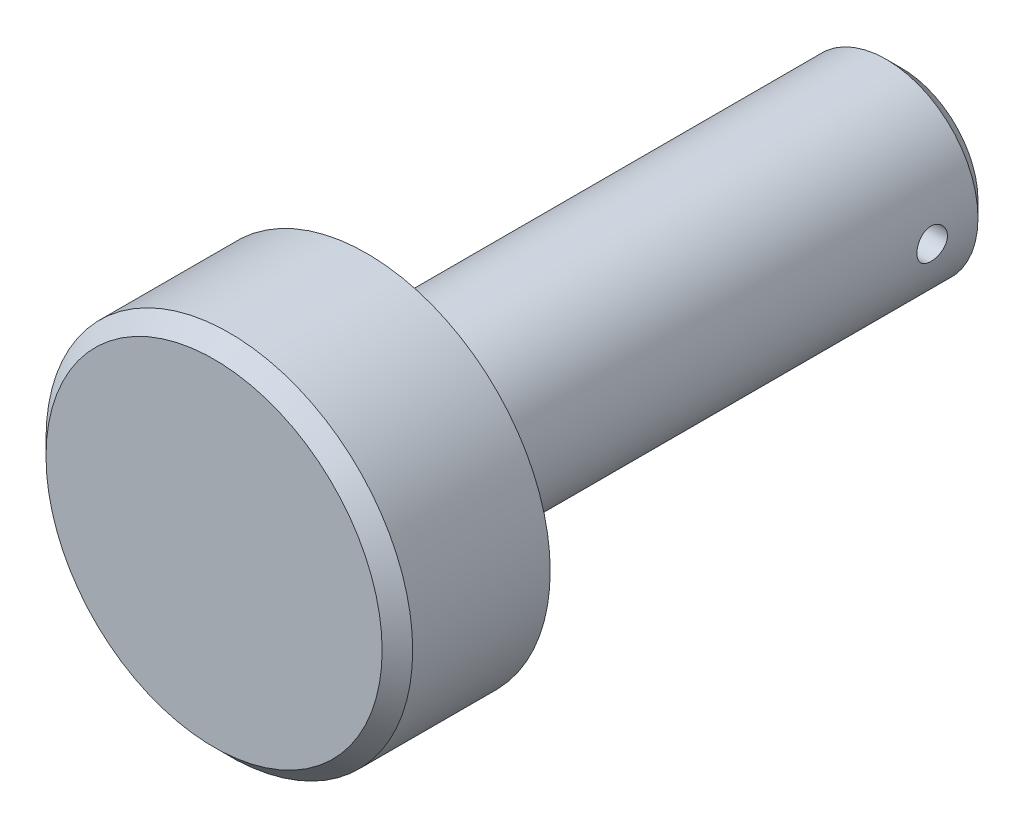
from build123d import *

# Parameters (mm, degrees)
CHAMFER_1_SIZE           = 1
CUT_EXTRUDE_1_DEPTH      = 49.093658626
CUT_EXTRUDE_1_DEPTH_BACK = 49.093658626
SKETCH_2_R               = 1


with BuildPart() as part:
    # 草圖1 → 旋轉1 (revolve)
    with BuildSketch(Plane(origin=(0, 0, 0), x_dir=(0, 0, -1), z_dir=(1, 0, 0)), mode=Mode.PRIVATE) as revolve_1_sk:
        Polygon((0, 0), (0, 12), (10, 12), (10, 6), (45, 6), (45, 0), align=None)
    revolve(revolve_1_sk.sketch.rotate(Axis((0, 0, 0), (0, 0, -1)), 90), axis=Axis((0, 0, 0), (0, 0, -1)))

    # 導角1
    chamfer_1_edges = [part.edges().sort_by_distance(p)[0] for p in [
        (-6, 0, -45),
        (-12, 0, 0),
    ]]
    chamfer(chamfer_1_edges, length=CHAMFER_1_SIZE)

    # 草圖2 → 伸長1 (cut, two sides: drawn at the far end of the back side and taken through both)
    with BuildSketch(Plane(origin=(0, 0, 0), x_dir=(0, 0, -1), z_dir=(1, 0, 0)).offset(-CUT_EXTRUDE_1_DEPTH_BACK)):
        with Locations((41, 0)):
            Circle(SKETCH_2_R)
    extrude(amount=CUT_EXTRUDE_1_DEPTH + CUT_EXTRUDE_1_DEPTH_BACK, mode=Mode.SUBTRACT)


solid = part.part
